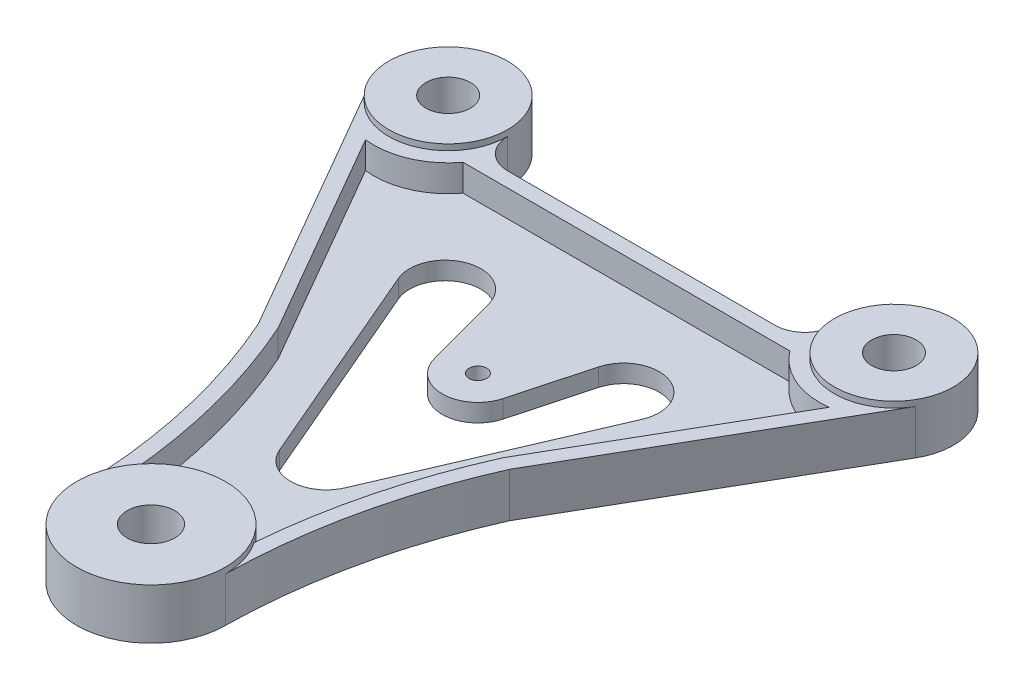
from build123d import *

# Parameters (mm, degrees)
SKETCH1_R             = 25
SKETCH1_R_2           = 8
BOSS_EXTRUDE1_DEPTH   = 17
SKETCH1_R_3           = 20
SKETCH1_R_4           = 7.5
BOSS_EXTRUDE1_2_DEPTH = 17
BOSS_EXTRUDE1_3_DEPTH = 17
BOSS_EXTRUDE4_DEPTH   = 15
SKETCH1_12_R          = 3
BOSS_EXTRUDE5_DEPTH   = 6


with BuildPart() as part:
    # Sketch1 → Boss-Extrude1 (new body)
    with BuildSketch(Plane(origin=(0, 0, 0), x_dir=(1, 0, 0), z_dir=(0, 1, 0))):
        Circle(SKETCH1_R)
        Circle(SKETCH1_R_2, mode=Mode.SUBTRACT)
    extrude(amount=BOSS_EXTRUDE1_DEPTH)



with BuildPart() as body_2:
    # Sketch1 → Boss-Extrude1 2 (new body)
    with BuildSketch(Plane(origin=(0, 0, 0), x_dir=(1, 0, 0), z_dir=(0, 1, 0))):
        with Locations((-75, 175)):
            Circle(SKETCH1_R_3)
        with Locations((-75, 175)):
            Circle(SKETCH1_R_4, mode=Mode.SUBTRACT)
    extrude(amount=BOSS_EXTRUDE1_2_DEPTH)


with BuildPart() as body_3:
    # Sketch1 → Boss-Extrude1 3 (new body)
    with BuildSketch(Plane(origin=(0, 0, 0), x_dir=(1, 0, 0), z_dir=(0, 1, 0))):
        with Locations((75, 175)):
            Circle(SKETCH1_R_3)
        with Locations((75, 175)):
            Circle(SKETCH1_R_4, mode=Mode.SUBTRACT)
    extrude(amount=BOSS_EXTRUDE1_3_DEPTH)


with BuildPart() as part_1:
    add(part.part)

    add(body_2.part)  # Boss-Extrude4 merges body 2

    add(body_3.part)  # Boss-Extrude4 merges body 3
    # Sketch1<11> → Boss-Extrude4 (add)
    with BuildSketch(Plane(origin=(0, 0, 0), x_dir=(1, 0, 0), z_dir=(0, 1, 0))):
        with BuildLine():
            Line((-37.860985847, 80.673340544), (-77.990381057, 150.179491924))
            ThreePointArc((-77.990381057, 150.179491924), (-65.179491924, 152.009618943), (-55, 160))
            Line((-55, 160), (55, 160))
            ThreePointArc((55, 160), (65.179491924, 152.009618943), (77.990381057, 150.179491924))
            Line((77.990381057, 150.179491924), (37.860985847, 80.673340544))
            ThreePointArc((37.860985847, 80.673340544), (26.459547, 48.078091436), (20.690948252, 14.031559444))
            ThreePointArc((20.690948252, 14.031559444), (23.898469682, 7.339151643), (25, 0))
            ThreePointArc((25, 0), (29.68582744, 40.076807855), (42.320508076, 78.397459622))
            Line((42.320508076, 78.397459622), (92.320508076, 165))
            ThreePointArc((92.320508076, 165), (69.823619098, 155.681483474), (55, 175))
            ThreePointArc((55, 175), (52.071067812, 167.928932188), (45, 165))
            Line((45, 165), (0, 165))
            Line((0, 165), (-45, 165))
            ThreePointArc((-45, 165), (-52.071067812, 167.928932188), (-55, 175))
            ThreePointArc((-55, 175), (-69.823619098, 155.681483474), (-92.320508076, 165))
            Line((-92.320508076, 165), (-42.320508076, 78.397459622))
            ThreePointArc((-42.320508076, 78.397459622), (-29.68582744, 40.076807855), (-25, 0))
            ThreePointArc((-25, 0), (-23.898469682, 7.339151643), (-20.690948252, 14.031559444))
            ThreePointArc((-20.690948252, 14.031559444), (-26.459547, 48.078091436), (-37.860985847, 80.673340544))
        make_face()
    extrude(amount=BOSS_EXTRUDE4_DEPTH)

    # Sketch1<12> → Boss-Extrude5 (add)
    with BuildSketch(Plane(origin=(0, 0, 0), x_dir=(1, 0, 0), z_dir=(0, 1, 0))):
        with BuildLine():
            ThreePointArc((-55, 160), (-65.179491924, 152.009618943), (-77.990381057, 150.179491924))
            Line((-77.990381057, 150.179491924), (-37.860985847, 80.673340544))
            ThreePointArc((-37.860985847, 80.673340544), (-26.459547, 48.078091436), (-20.690948252, 14.031559444))
            ThreePointArc((-20.690948252, 14.031559444), (0, 25), (20.690948252, 14.031559444))
            ThreePointArc((20.690948252, 14.031559444), (26.459547, 48.078091436), (37.860985847, 80.673340544))
            Line((37.860985847, 80.673340544), (77.990381057, 150.179491924))
            ThreePointArc((77.990381057, 150.179491924), (65.179491924, 152.009618943), (55, 160))
            Line((55, 160), (-55, 160))
        make_face()
        with BuildLine():
            Line((41.02974036, 124.272968417), (11.02974036, 54.272968417))
            ThreePointArc((11.02974036, 54.272968417), (0, 47), (-11.02974036, 54.272968417))
            Line((-11.02974036, 54.272968417), (-41.02974036, 124.272968417))
            ThreePointArc((-41.02974036, 124.272968417), (-33.939530359, 140.334906288), (-18.416073702, 132.132515207))
            Line((-18.416073702, 132.132515207), (-11.583926298, 106.867484793))
            ThreePointArc((-11.583926298, 106.867484793), (0, 98), (11.583926298, 106.867484793))
            Line((11.583926298, 106.867484793), (18.416073702, 132.132515207))
            ThreePointArc((18.416073702, 132.132515207), (33.939530359, 140.334906288), (41.02974036, 124.272968417))
        make_face(mode=Mode.SUBTRACT)
        with Locations((0, 110)):
            Circle(SKETCH1_12_R, mode=Mode.SUBTRACT)
    extrude(amount=BOSS_EXTRUDE5_DEPTH)


solid = part_1.part
